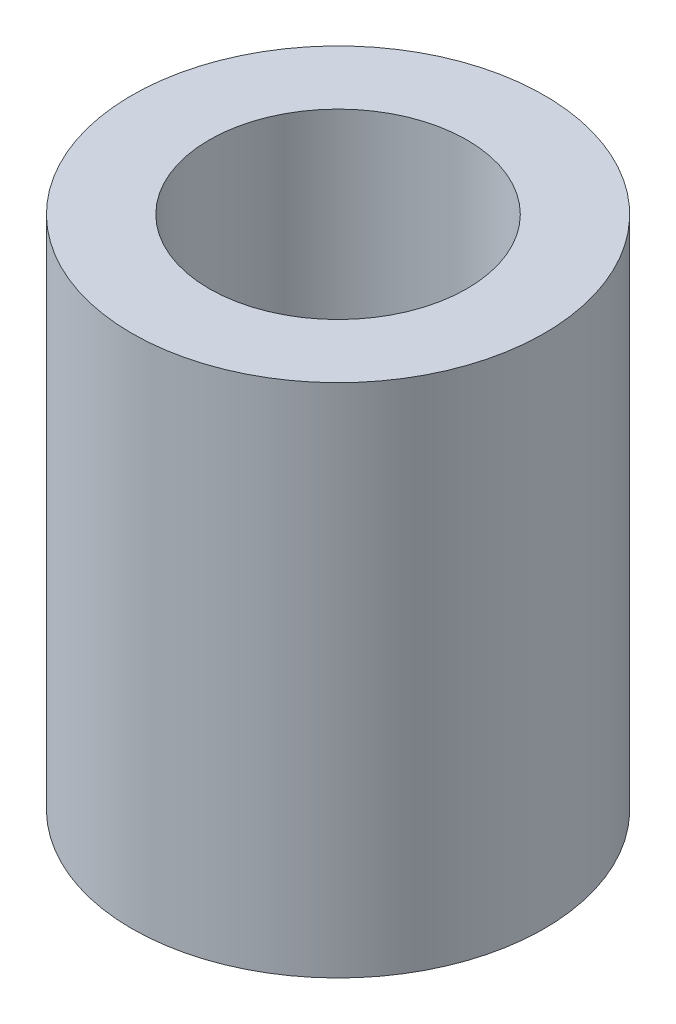
from build123d import *

# Parameters (mm, degrees)
SKETCH1_R           = 4
SKETCH1_R_2         = 2.5
BOSS_EXTRUDE1_DEPTH = 5


with BuildPart() as part:
    # Sketch1 → Boss-Extrude1 (new, symmetric)
    with BuildSketch(Plane(origin=(0, 0, 0), x_dir=(1, 0, 0), z_dir=(0, 1, 0))):
        with Locations(Location((0, 0, 0), (0, 0, 270))):
            Circle(SKETCH1_R)
        with Locations(Location((0, 0, 0), (0, 0, 270))):
            Circle(SKETCH1_R_2, mode=Mode.SUBTRACT)
    extrude(amount=BOSS_EXTRUDE1_DEPTH, both=True)


solid = part.part
